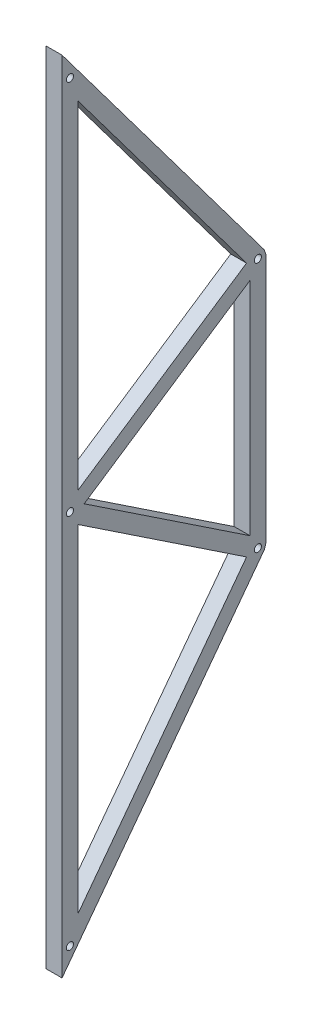
from build123d import *

# Parameters (mm, degrees)
SKETCH1_R           = 5.71
BOSS_EXTRUDE1_DEPTH = 25.23


with BuildPart() as part:
    # Sketch1 → Boss-Extrude1 (new body)
    with BuildSketch(Plane.YZ):
        Polygon((0, 12.615), (-637.845, 12.615), (-207.569, -310.092), (-200, -312.615), (200, -312.615), (207.569, -310.092), (637.845, 12.615), align=None)
        with Locations(Location((-600, 0, 0), (0, 0, 270))):
            Circle(SKETCH1_R, mode=Mode.SUBTRACT)
        with Locations(Location((0, 0, 0), (0, 0, 270))):
            Circle(SKETCH1_R, mode=Mode.SUBTRACT)
        with Locations(Location((-200, -300, 0), (0, 0, 270))):
            Circle(SKETCH1_R, mode=Mode.SUBTRACT)
        with Locations(Location((200, -300, 0), (0, 0, 270))):
            Circle(SKETCH1_R, mode=Mode.SUBTRACT)
        with Locations(Location((600, 0, 0), (0, 0, 270))):
            Circle(SKETCH1_R, mode=Mode.SUBTRACT)
        Polygon((176.428656887, -287.385), (0, -22.74201467), (-176.428656887, -287.385), align=None, mode=Mode.SUBTRACT)
        Polygon((-562.155, -12.615), (-203.099228742, -281.906828443), (-23.571343113, -12.615), align=None, mode=Mode.SUBTRACT)
        Polygon((203.099228742, -281.906828443), (562.155, -12.615), (23.571343113, -12.615), align=None, mode=Mode.SUBTRACT)
    extrude(amount=BOSS_EXTRUDE1_DEPTH)


solid = part.part
